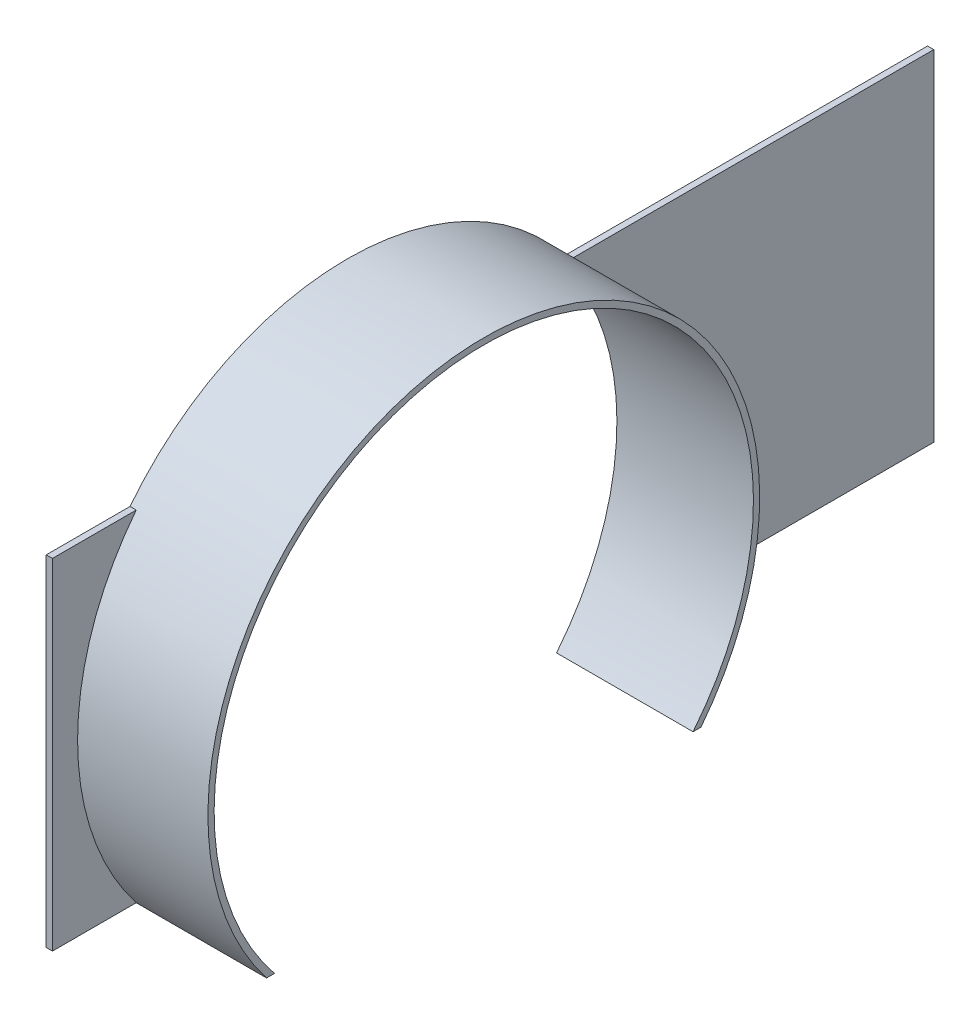
from build123d import *
from build123d.topology import SkipClean

# Parameters (mm, degrees)
BOSS_EXTRUDE1_DEPTH = 42.000000074
BOSS_EXTRUDE2_START = 2.000000064
BOSS_EXTRUDE2_DEPTH = 2.000000064


with BuildPart() as part:
    # Sketch1 → Boss-Extrude1 (new body)
    with BuildSketch(Plane.ZY):
        with BuildLine():
            Line((-45.001214275, 0), (-42.443087035, 0))
            ThreePointArc((-42.443087035, 0), (25, 141.699999936), (92.443087035, 0))
            Line((92.443087035, 0), (95.001214275, 0))
            ThreePointArc((95.001214275, 0), (25, 143.7), (-45.001214275, 0))
        make_face()
    extrude(amount=-BOSS_EXTRUDE1_DEPTH)

    # Sketch2 → Boss-Extrude2 (add)
    with SkipClean():  # the faces are left unmerged after this step: merging them gives an invalid solid
        with BuildSketch(Plane.ZY.offset(BOSS_EXTRUDE2_START)):
            with BuildLine():
                Line((-160, 0), (-45.001214275, 0))
                ThreePointArc((-45.001214275, 0), (-63.9, 54.8), (-45.001214275, 109.6))
                Line((-45.001214275, 109.6), (-160, 109.6))
                Line((-160, 109.6), (-162.000000064, 109.6))
                Line((-162.000000064, 109.6), (-162.000000064, 0))
                Line((-162.000000064, 0), (-160, 0))
            make_face()
            with BuildLine():
                ThreePointArc((-45.001214275, 0), (25, 143.7), (95.001214275, 0))
                Line((95.001214275, 0), (92.443087035, 0))
                ThreePointArc((92.443087035, 0), (25, 141.699999936), (-42.443087035, 0))
                Line((-42.443087035, 0), (-45.001214275, 0))
            make_face()
            with BuildLine():
                ThreePointArc((95.001214275, 109.6), (113.9, 54.8), (95.001214275, 0))
                Line((95.001214275, 0), (120, 0))
                Line((120, 0), (122.000000064, 0))
                Line((122.000000064, 0), (122.000000064, 109.6))
                Line((122.000000064, 109.6), (120, 109.6))
                Line((120, 109.6), (95.001214275, 109.6))
            make_face()
        extrude(amount=-BOSS_EXTRUDE2_DEPTH)


solid = part.part
